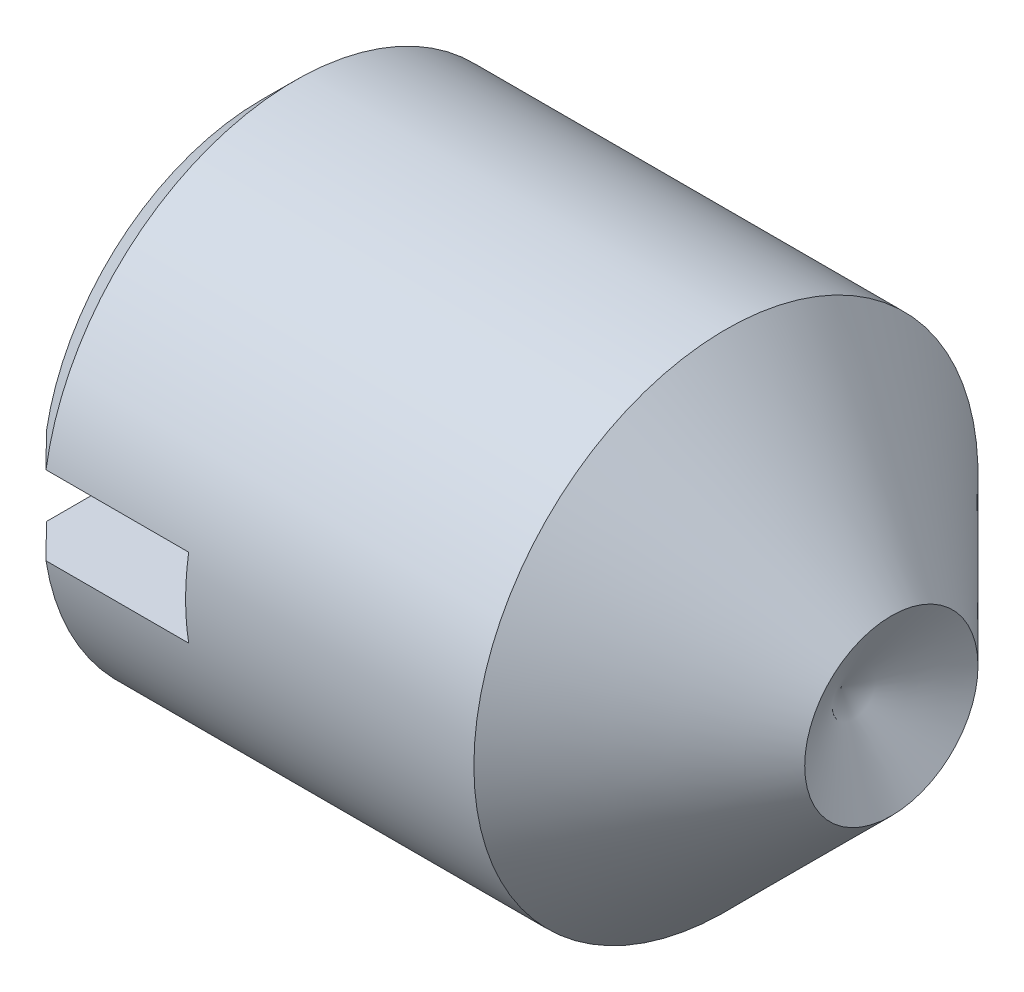
from build123d import *

# Parameters (mm, degrees)
SKETCH_3_W          = 0.56
SKETCH_3_H          = 0.25
CUT_EXTRUDE_1_DEPTH = 50


with BuildPart() as part:
    # 草图2 → Revolve 583 (revolve)
    with BuildSketch(Plane.XY, mode=Mode.PRIVATE) as revolve_583_sk:
        Polygon((0, 0), (2, 0), (2, 0.275), (1.475, 0.8), (0.1072, 0.8), (0, 0.6928), align=None)
    revolve(revolve_583_sk.sketch.rotate(Axis((5.249298441, 0, 0), (1, 0, 0)), 90), axis=Axis((5.249298441, 0, 0), (1, 0, 0)))

    # 草图3 → 切除-拉伸1 (cut, symmetric)
    with BuildSketch(Plane.XY):
        with Locations((0.28, 0)):
            Rectangle(SKETCH_3_W, SKETCH_3_H)
    extrude(amount=CUT_EXTRUDE_1_DEPTH, both=True, mode=Mode.SUBTRACT)

    # 草图5 → 切除-旋转2 (revolve, cut)
    with BuildSketch(Plane.XY, mode=Mode.PRIVATE) as cut_revolve_2_sk:
        Polygon((2, 0), (1.841228676, 0), (2, -0.275), align=None)
    revolve(cut_revolve_2_sk.sketch.rotate(Axis((7.723304106, 0, 0), (1, 0, 0)), 180), axis=Axis((7.723304106, 0, 0), (1, 0, 0)), mode=Mode.SUBTRACT)


solid = part.part
